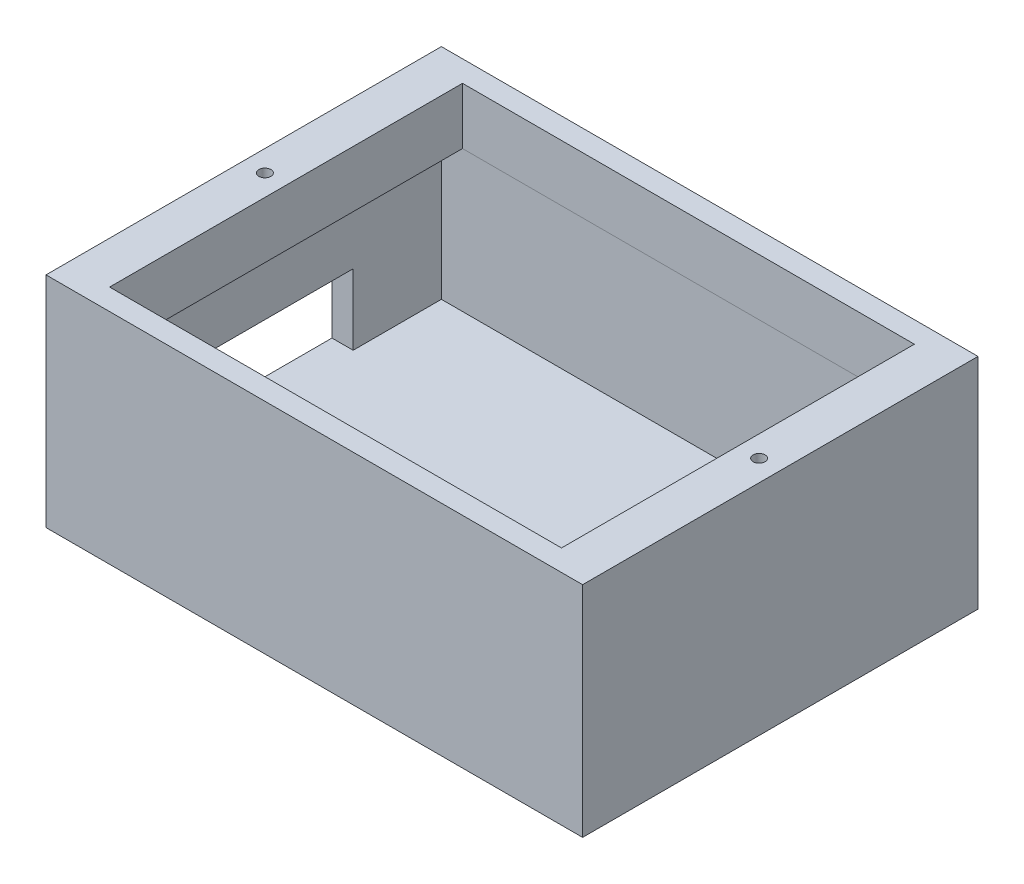
from build123d import *

# Parameters (mm, degrees)
SKETCH1_W           = 76
SKETCH1_H           = 56
BOSS_EXTRUDE1_DEPTH = 3
SKETCH2_W           = 76
SKETCH2_H           = 56
SKETCH2_W_2         = 70
SKETCH2_H_2         = 50
BOSS_EXTRUDE2_DEPTH = 28
CUT_EXTRUDE1_REACH  = 88.724
SKETCH3_W           = 25
SKETCH3_H           = 10
BOSS_EXTRUDE3_START = 31
SKETCH4_W           = 70
SKETCH4_H           = 50
SKETCH4_W_2         = 64
SKETCH4_H_2         = 49.98
BOSS_EXTRUDE3_DEPTH = 8
SKETCH5_R           = 0.85
CUT_EXTRUDE2_DEPTH  = 5


with BuildPart() as part:
    # Sketch1 → Boss-Extrude1 (new body)
    with BuildSketch(Plane(origin=(0, 0, 0), x_dir=(1, 0, 0), z_dir=(0, 1, 0))):
        Rectangle(SKETCH1_W, SKETCH1_H)
    extrude(amount=BOSS_EXTRUDE1_DEPTH)

    # Sketch2 → Boss-Extrude2 (add)
    with BuildSketch(Plane(origin=(0, 3, 0), x_dir=(1, 0, 0), z_dir=(0, 1, 0))):
        Rectangle(SKETCH2_W, SKETCH2_H)
        Rectangle(SKETCH2_W_2, SKETCH2_H_2, mode=Mode.SUBTRACT)
    extrude(amount=BOSS_EXTRUDE2_DEPTH)

    # Sketch3 → Cut-Extrude1 (cut, up to next)
    with BuildSketch(Plane.ZY.offset(38), mode=Mode.PRIVATE) as cut_extrude1_sk1:
        with Locations((0, 8)):
            Rectangle(SKETCH3_W, SKETCH3_H)
    cut_extrude1_tool1 = extrude(cut_extrude1_sk1.sketch, amount=-CUT_EXTRUDE1_REACH, mode=Mode.PRIVATE) & part.part
    add(cut_extrude1_tool1.solids().sort_by_distance((-38, 8, 0))[0], mode=Mode.SUBTRACT)

    # Sketch4 → Boss-Extrude3 (add)
    with BuildSketch(Plane(origin=(0, 0, 0), x_dir=(1, 0, 0), z_dir=(0, 1, 0)).offset(BOSS_EXTRUDE3_START)):
        Rectangle(SKETCH4_W, SKETCH4_H)
        Rectangle(SKETCH4_W_2, SKETCH4_H_2, mode=Mode.SUBTRACT)
    extrude(amount=-BOSS_EXTRUDE3_DEPTH)

    # Sketch5 → Cut-Extrude2 (cut)
    with BuildSketch(Plane(origin=(0, 31, 0), x_dir=(1, 0, 0), z_dir=(0, 1, 0))):
        with Locations(Location((-35, 0, 0), (0, 0, 270))):
            Circle(SKETCH5_R)
        with Locations(Location((35, 0, 0), (0, 0, 90))):
            Circle(SKETCH5_R)
    extrude(amount=-CUT_EXTRUDE2_DEPTH, mode=Mode.SUBTRACT)


solid = part.part
